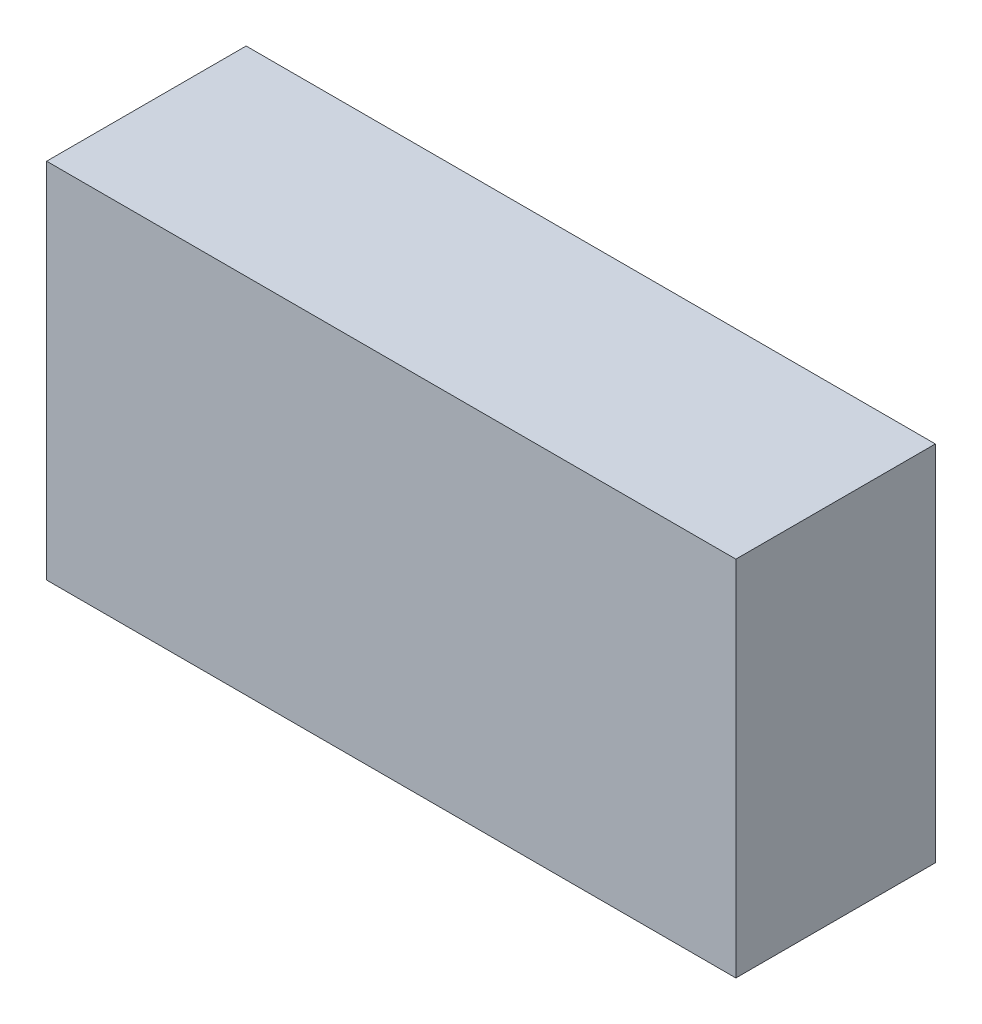
from build123d import *

# Parameters (mm, degrees)
SKETCH_1_W      = 38
SKETCH_1_H      = 20
EXTRUDE_1_DEPTH = 11


with BuildPart() as part:
    # 草图1 → 凸台-拉伸1 (new body)
    with BuildSketch(Plane.XY):
        with Locations((19, -10)):
            Rectangle(SKETCH_1_W, SKETCH_1_H)
    extrude(amount=EXTRUDE_1_DEPTH)


solid = part.part
